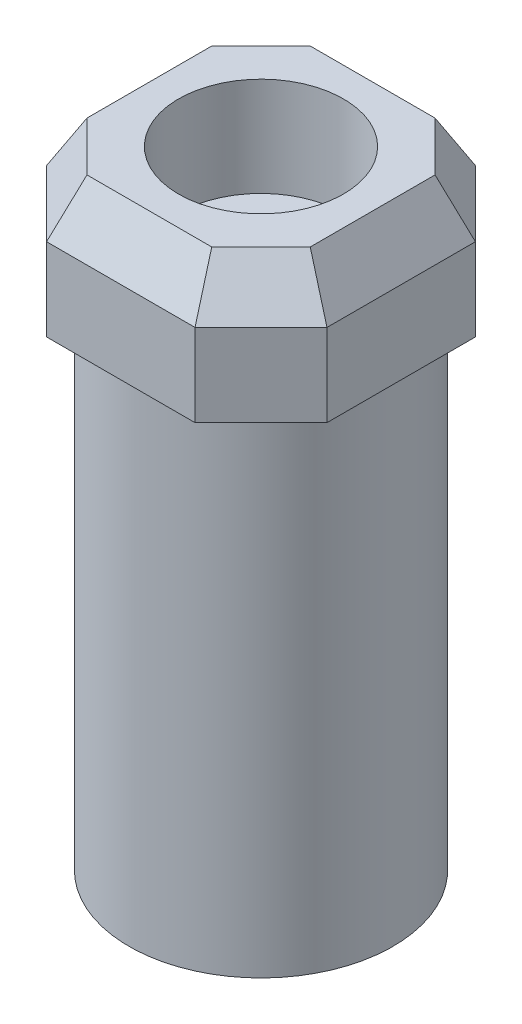
from build123d import *
from OCP.BRepFilletAPI import BRepFilletAPI_MakeChamfer

# Parameters (mm, degrees)
SKETCH1_W           = 17
SKETCH1_H           = 17
BOSS_EXTRUDE1_DEPTH = 8
SKETCH5_R           = 8
BOSS_EXTRUDE3_DEPTH = 30
SKETCH6_R           = 6
CUT_EXTRUDE5_DEPTH  = 30
CUT_EXTRUDE6_DEPTH  = 33.318725222
CHAMFER1_SIZE       = 4
SKETCH11_R          = 5
CUT_EXTRUDE7_DEPTH  = 6
CHAMFER2_SIZE       = 3
CHAMFER2_SIZE2      = 1.732050808


with BuildPart() as part:
    # Sketch1 → Boss-Extrude1 (new body)
    with BuildSketch(Plane(origin=(0, 0, 0), x_dir=(1, 0, 0), z_dir=(0, 1, 0))):
        Rectangle(SKETCH1_W, SKETCH1_H)
    extrude(amount=BOSS_EXTRUDE1_DEPTH)

    # Sketch5 → Boss-Extrude3 (add)
    with BuildSketch(Plane.XZ):
        with Locations(Location((0, 0, 0), (0, 0, 270))):
            Circle(SKETCH5_R)
    extrude(amount=BOSS_EXTRUDE3_DEPTH)

    # Sketch6 → Cut-Extrude5 (cut)
    with BuildSketch(Plane.XZ.offset(30)):
        with Locations(Location((0, 0, 0), (0, 0, 270))):
            Circle(SKETCH6_R)
    extrude(amount=-CUT_EXTRUDE5_DEPTH, mode=Mode.SUBTRACT)

    # Sketch8 → Cut-Extrude6 (cut, through all)
    with BuildSketch(Plane(origin=(0, 0, 0), x_dir=(0, 0, -1), z_dir=(1, 0, 0))):
        with BuildLine():
            Line((-1.4, -20), (-1.4, -10))
            ThreePointArc((-1.4, -10), (0, -8.6), (1.4, -10))
            Line((1.4, -10), (1.4, -20))
            ThreePointArc((1.4, -20), (0, -21.4), (-1.4, -20))
        make_face()
    extrude(amount=-CUT_EXTRUDE6_DEPTH, mode=Mode.SUBTRACT)

    # Chamfer1
    chamfer1_edges = [part.edges().sort_by_distance(p)[0] for p in [
        (8.5, 4, 8.5),
        (-8.5, 4, 8.5),
        (-8.5, 4, -8.5),
        (8.5, 4, -8.5),
    ]]
    chamfer(chamfer1_edges, length=CHAMFER1_SIZE)

    # Sketch11 → Cut-Extrude7 (cut)
    with BuildSketch(Plane(origin=(0, 8, 0), x_dir=(1, 0, 0), z_dir=(0, 1, 0))):
        with Locations(Location((0, 0, 0), (0, 0, 270))):
            Circle(SKETCH11_R)
    extrude(amount=-CUT_EXTRUDE7_DEPTH, mode=Mode.SUBTRACT)

    # Chamfer2: one chamfer whose edges measure the first distance from different faces: ONE call of the kernel's chamfer builder (chamfer() names one face for all edges)
    chamfer2_edges_1 = [part.edges().sort_by_distance(p)[0] for p in [
        (0, 8, 8.5),
    ]]
    chamfer2_side_1 = [part.faces().sort_by_distance(p)[0] for p in [
        (0, 4, 8.5),
    ]]
    chamfer2_edges_2 = [part.edges().sort_by_distance(p)[0] for p in [
        (-8.5, 8, 0),
    ]]
    chamfer2_side_2 = [part.faces().sort_by_distance(p)[0] for p in [
        (-8.5, 4, 0),
    ]]
    chamfer2_edges_3 = [part.edges().sort_by_distance(p)[0] for p in [
        (8.5, 8, 0),
    ]]
    chamfer2_side_3 = [part.faces().sort_by_distance(p)[0] for p in [
        (8.5, 4, 0),
    ]]
    chamfer2_edges_4 = [part.edges().sort_by_distance(p)[0] for p in [
        (0, 8, -8.5),
    ]]
    chamfer2_side_4 = [part.faces().sort_by_distance(p)[0] for p in [
        (0, 4, -8.5),
    ]]
    chamfer2_edges_5 = [part.edges().sort_by_distance(p)[0] for p in [
        (6.5, 8, -6.5),
    ]]
    chamfer2_side_5 = [part.faces().sort_by_distance(p)[0] for p in [
        (6.5, 4, -6.5),
    ]]
    chamfer2_edges_6 = [part.edges().sort_by_distance(p)[0] for p in [
        (-6.5, 8, -6.5),
    ]]
    chamfer2_side_6 = [part.faces().sort_by_distance(p)[0] for p in [
        (-6.5, 4, -6.5),
    ]]
    chamfer2_edges_7 = [part.edges().sort_by_distance(p)[0] for p in [
        (6.5, 8, 6.5),
    ]]
    chamfer2_side_7 = [part.faces().sort_by_distance(p)[0] for p in [
        (6.5, 4, 6.5),
    ]]
    chamfer2_edges_8 = [part.edges().sort_by_distance(p)[0] for p in [
        (-6.5, 8, 6.5),
    ]]
    chamfer2_side_8 = [part.faces().sort_by_distance(p)[0] for p in [
        (-6.5, 4, 6.5),
    ]]
    chamfer2 = BRepFilletAPI_MakeChamfer(part.part.solid().wrapped)
    for e in chamfer2_edges_1:
        chamfer2.Add(CHAMFER2_SIZE, CHAMFER2_SIZE2, e.wrapped, chamfer2_side_1[0].wrapped)  # the first distance lies on this face
    for e in chamfer2_edges_2:
        chamfer2.Add(CHAMFER2_SIZE, CHAMFER2_SIZE2, e.wrapped, chamfer2_side_2[0].wrapped)  # the first distance lies on this face
    for e in chamfer2_edges_3:
        chamfer2.Add(CHAMFER2_SIZE, CHAMFER2_SIZE2, e.wrapped, chamfer2_side_3[0].wrapped)  # the first distance lies on this face
    for e in chamfer2_edges_4:
        chamfer2.Add(CHAMFER2_SIZE, CHAMFER2_SIZE2, e.wrapped, chamfer2_side_4[0].wrapped)  # the first distance lies on this face
    for e in chamfer2_edges_5:
        chamfer2.Add(CHAMFER2_SIZE, CHAMFER2_SIZE2, e.wrapped, chamfer2_side_5[0].wrapped)  # the first distance lies on this face
    for e in chamfer2_edges_6:
        chamfer2.Add(CHAMFER2_SIZE, CHAMFER2_SIZE2, e.wrapped, chamfer2_side_6[0].wrapped)  # the first distance lies on this face
    for e in chamfer2_edges_7:
        chamfer2.Add(CHAMFER2_SIZE, CHAMFER2_SIZE2, e.wrapped, chamfer2_side_7[0].wrapped)  # the first distance lies on this face
    for e in chamfer2_edges_8:
        chamfer2.Add(CHAMFER2_SIZE, CHAMFER2_SIZE2, e.wrapped, chamfer2_side_8[0].wrapped)  # the first distance lies on this face
    add(Compound.cast(chamfer2.Shape()), mode=Mode.REPLACE)


solid = part.part
